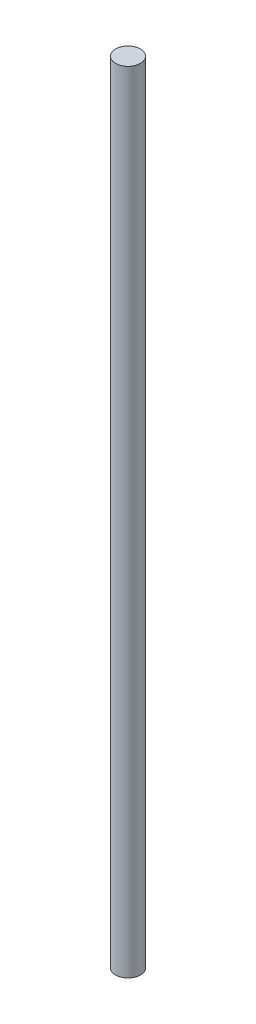
from build123d import *

# Parameters (mm, degrees)
SKETCH1_R           = 0.6
BOSS_EXTRUDE1_DEPTH = 38


with BuildPart() as part:
    # Sketch1 → Boss-Extrude1 (new body)
    with BuildSketch(Plane(origin=(0, 0, 0), x_dir=(1, 0, 0), z_dir=(0, 1, 0))):
        with Locations(Location((0, 0, 0), (0, 0, 270))):
            Circle(SKETCH1_R)
    extrude(amount=BOSS_EXTRUDE1_DEPTH)


solid = part.part
